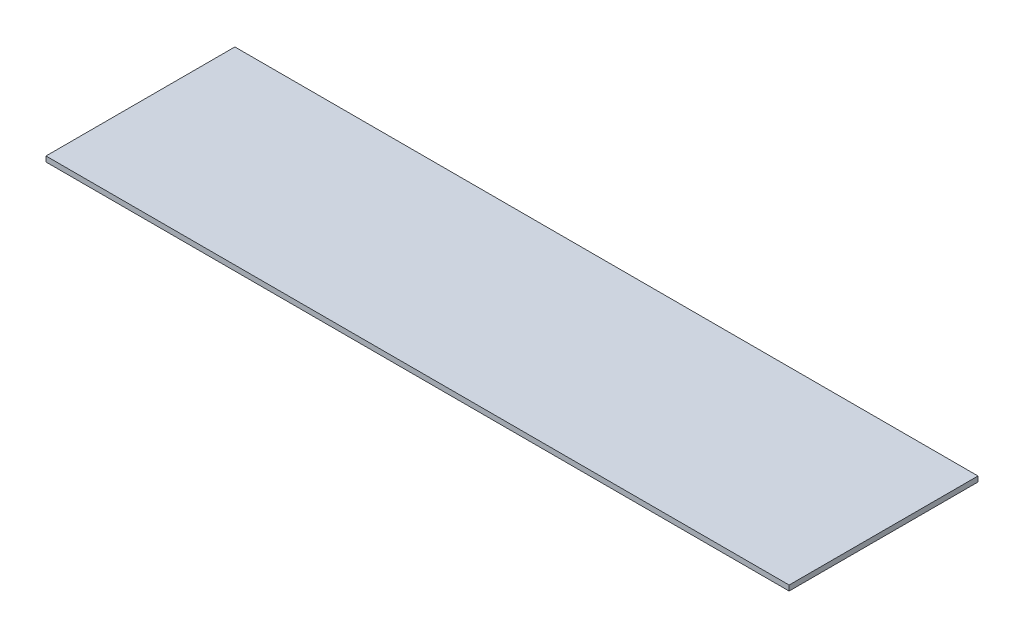
from build123d import *

# Parameters (mm, degrees)
SKETCH1_W           = 325
SKETCH1_H           = 82.6
BOSS_EXTRUDE1_DEPTH = 2.3


with BuildPart() as part:
    # Sketch1 → Boss-Extrude1 (new body)
    with BuildSketch(Plane(origin=(0, 0, 0), x_dir=(1, 0, 0), z_dir=(0, 1, 0))):
        Rectangle(SKETCH1_W, SKETCH1_H)
    extrude(amount=BOSS_EXTRUDE1_DEPTH)


solid = part.part
